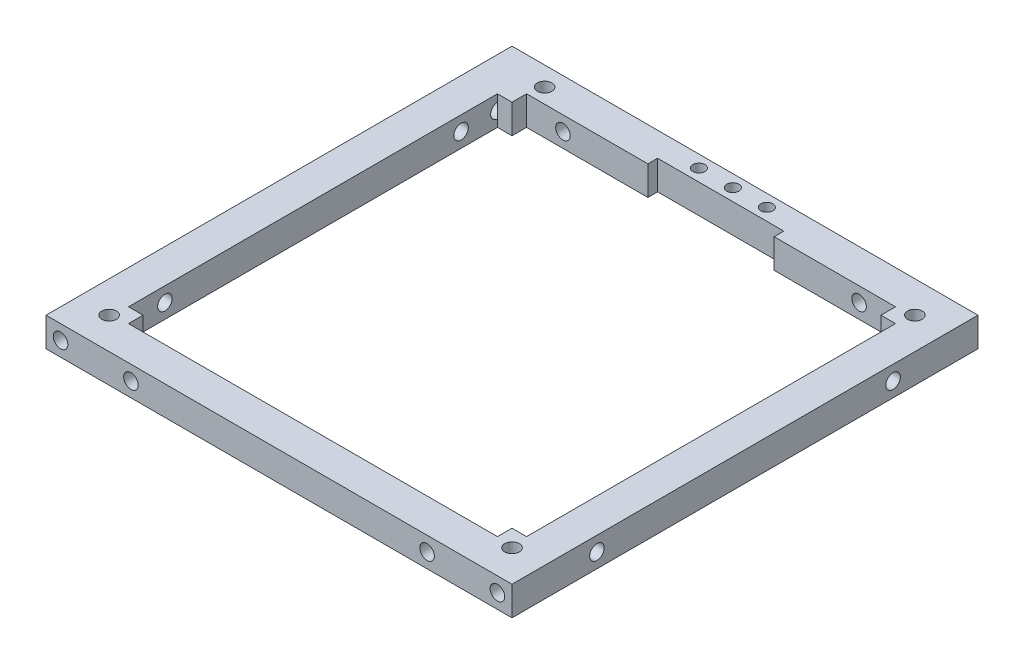
from build123d import *

# Parameters (mm, degrees)
SKETCH1_W                       = 96
SKETCH1_H                       = 96
SKETCH1_W_2                     = 80
SKETCH1_H_2                     = 80
BOSS_EXTRUDE1_DEPTH             = 8
F_3_0_3_DIAMETER_HOLE6_D        = 3
F_3_0_3_DIAMETER_HOLE6_DEPTH    = 6
F_3_0_3_DIAMETER_HOLE3_D        = 3
F_3_0_3_DIAMETER_HOLE3_DEPTH    = 6
SKETCH27_W                      = 82
SKETCH27_H                      = 82
CUT_EXTRUDE2_DEPTH              = 10
F_3_0_3_DIAMETER_HOLE1_D        = 3
F_3_0_3_DIAMETER_HOLE2_D        = 3
SKETCH35_W                      = 3
SKETCH35_H                      = 3
BOSS_EXTRUDE2_DEPTH             = 8
F_3_0_3_DIAMETER_HOLE7_D        = 3
SKETCH44_W                      = 96
SKETCH44_H                      = 1
CUT_EXTRUDE4_DEPTH              = 142
SKETCH47_W                      = 14
SKETCH47_H                      = 2
CUT_EXTRUDE5_DEPTH              = 10
F_2_5_2_5_DIAMETER_HOLE1_D      = 2.5
TAP_DRILL_FOR_M3X0_5_TAP3_D     = 3
TAP_DRILL_FOR_M3X0_5_TAP3_DEPTH = 7
SKETCH54_W                      = 6
SKETCH54_H                      = 6
CUT_EXTRUDE6_DEPTH              = 2


with BuildPart() as part:
    # Sketch1 → Boss-Extrude1 (new body)
    with BuildSketch(Plane(origin=(0, 0, 0), x_dir=(1, 0, 0), z_dir=(0, 1, 0))):
        Rectangle(SKETCH1_W, SKETCH1_H)
        Rectangle(SKETCH1_W_2, SKETCH1_H_2, mode=Mode.SUBTRACT)
    extrude(amount=BOSS_EXTRUDE1_DEPTH)

    # Ø3.0 (3) Diameter Hole6
    with Locations(Plane.XY.offset(48)):
        with Locations((45, 4), (-45, 4)):
            Hole(F_3_0_3_DIAMETER_HOLE6_D / 2, depth=F_3_0_3_DIAMETER_HOLE6_DEPTH)

    # Ø3.0 (3) Diameter Hole3
    with Locations(Plane(origin=(0, 0, -48), x_dir=(-1, 0, 0), z_dir=(0, 0, -1))):
        with Locations((-45, 4), (45, 4)):
            Hole(F_3_0_3_DIAMETER_HOLE3_D / 2, depth=F_3_0_3_DIAMETER_HOLE3_DEPTH)

    # Sketch27 → Cut-Extrude2 (cut)
    with BuildSketch(Plane(origin=(0, 8, 0), x_dir=(1, 0, 0), z_dir=(0, 1, 0))):
        Rectangle(SKETCH27_W, SKETCH27_H)
    extrude(amount=-CUT_EXTRUDE2_DEPTH, mode=Mode.SUBTRACT)

    # Ø3.0 (3) Diameter Hole1 (through all)
    with Locations(Plane.XY.offset(48)):
        with Locations((-30.5, 4), (30.5, 4)):
            Hole(F_3_0_3_DIAMETER_HOLE1_D / 2)

    # Ø3.0 (3) Diameter Hole2 (through all)
    with Locations(Plane.ZY.offset(48)):
        with Locations((-30.5, 4), (30.5, 4)):
            Hole(F_3_0_3_DIAMETER_HOLE2_D / 2)

    # Sketch35 → Boss-Extrude2 (add)
    with BuildSketch(Plane(origin=(0, 8, 0), x_dir=(1, 0, 0), z_dir=(0, 1, 0))):
        with Locations((39.5, -39.5)):
            Rectangle(SKETCH35_W, SKETCH35_H)
        with Locations((-39.5, 39.5)):
            Rectangle(SKETCH35_W, SKETCH35_H)
        with Locations((39.5, 39.5)):
            Rectangle(SKETCH35_W, SKETCH35_H)
        with Locations((-39.5, -39.5)):
            Rectangle(SKETCH35_W, SKETCH35_H)
    extrude(amount=-BOSS_EXTRUDE2_DEPTH)

    # Ø3.0 (3) Diameter Hole7 (through all)
    with Locations(Plane(origin=(0, 8, 0), x_dir=(1, 0, 0), z_dir=(0, 1, 0))):
        with Locations((-37.33, 44.05), (41.5, 41.5), (41.5, -41.5), (-41.5, -41.5)):
            Hole(F_3_0_3_DIAMETER_HOLE7_D / 2)

    # Sketch44 → Cut-Extrude4 (cut)
    with BuildSketch(Plane(origin=(0, 0, -48), x_dir=(-1, 0, 0), z_dir=(0, 0, -1))):
        with Locations((0, 7.5)):
            Rectangle(SKETCH44_W, SKETCH44_H)
        with Locations((0, 0.5)):
            Rectangle(SKETCH44_W, SKETCH44_H)
    extrude(amount=-CUT_EXTRUDE4_DEPTH, mode=Mode.SUBTRACT)

    # Sketch47 → Cut-Extrude5 (cut)
    with BuildSketch(Plane(origin=(0, 7, 0), x_dir=(1, 0, 0), z_dir=(0, 1, 0))):
        with Locations((0, 42)):
            Rectangle(SKETCH47_W, SKETCH47_H)
    extrude(amount=-CUT_EXTRUDE5_DEPTH, mode=Mode.SUBTRACT)

    # Ø2.5 (2.5) Diameter Hole1 (through all)
    with Locations(Plane(origin=(0, 1, 0), x_dir=(-1, 0, 0), z_dir=(0, -1, 0))):
        with Locations((7, 45.5), (0, 45.5), (-7, 45.5)):
            Hole(F_2_5_2_5_DIAMETER_HOLE1_D / 2)

    # Tap Drill for M3x0.5 Tap3
    with Locations(Plane.ZY.offset(48)):
        with Locations((38.1, 4), (-38.1, 4)):
            Hole(TAP_DRILL_FOR_M3X0_5_TAP3_D / 2, depth=TAP_DRILL_FOR_M3X0_5_TAP3_DEPTH)

    # Sketch54 → Cut-Extrude6 (cut)
    with BuildSketch(Plane.XY.offset(-41)):
        with Locations((-10, 4)):
            Rectangle(SKETCH54_W, SKETCH54_H)
        with Locations((10, 4)):
            Rectangle(SKETCH54_W, SKETCH54_H)
    extrude(amount=-CUT_EXTRUDE6_DEPTH, mode=Mode.SUBTRACT)


solid = part.part
